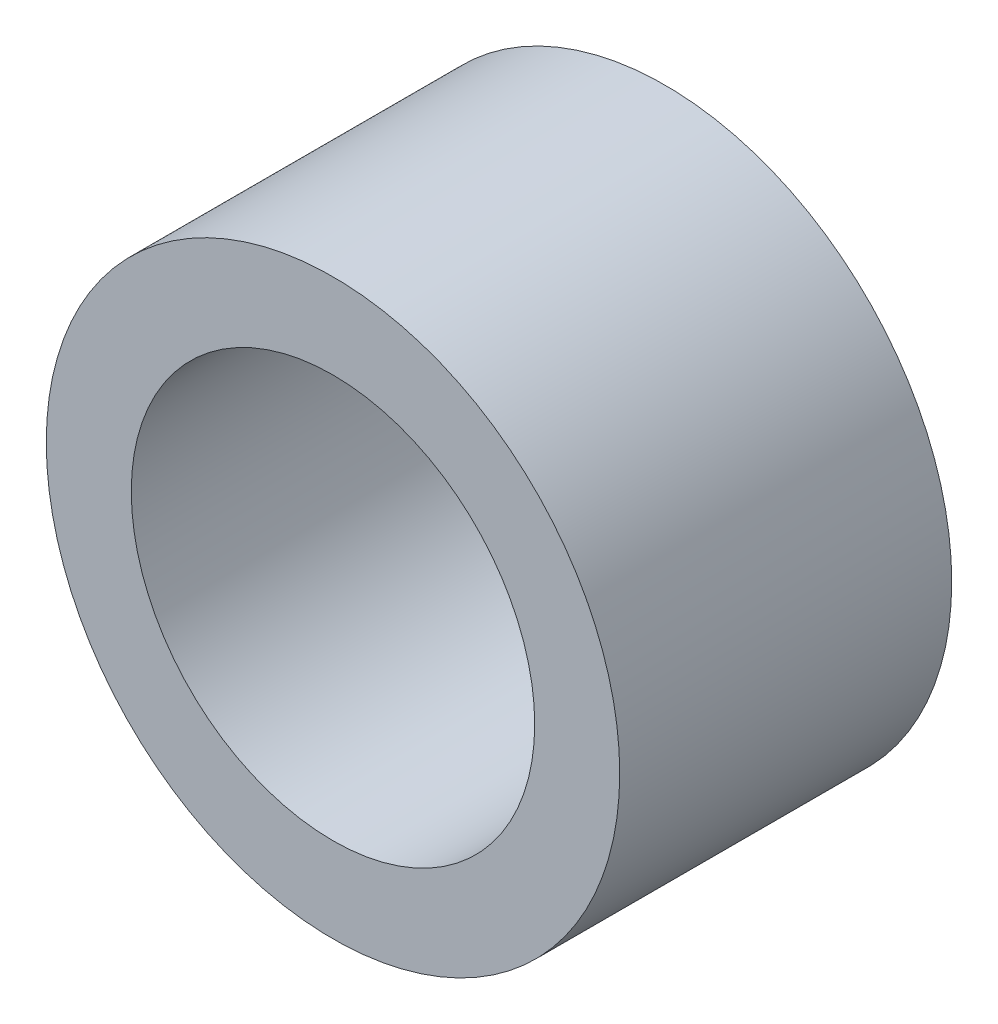
from build123d import *

# Parameters (mm, degrees)
TREAD_ANNULUS_PROFILE_R   = 28.5
TREAD_ANNULUS_PROFILE_R_2 = 20.05
TREAD_ANNULUS_DEPTH       = 33


with BuildPart() as part:
    # Tread annulus profile → Tread annulus (new body)
    with BuildSketch(Plane.XY):
        Circle(TREAD_ANNULUS_PROFILE_R)
        Circle(TREAD_ANNULUS_PROFILE_R_2, mode=Mode.SUBTRACT)
    extrude(amount=TREAD_ANNULUS_DEPTH)


solid = part.part
